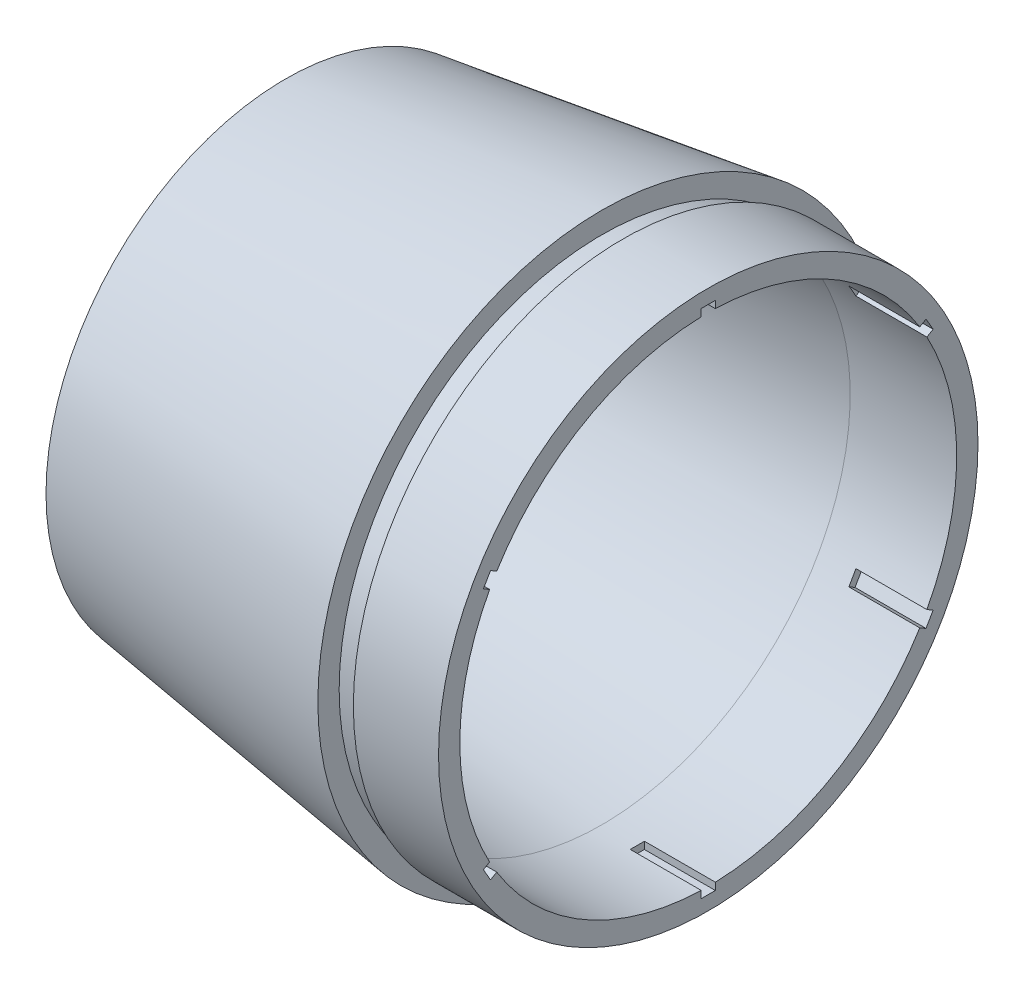
from build123d import *

# Parameters (mm, degrees)
IZIM3_W                 = 10
IZIM3_H                 = 2
KES_EKSTR_ZYON1_DEPTH   = 36
DAIRESEL_KAPLAMA1_COUNT = 6


with BuildPart() as part:
    # Çizim1 → Döndür2 (revolve)
    with BuildSketch(Plane.XY):
        Polygon((0, 40), (-44.562063093, 33.737210457), (-44.562063093, 31.737210457), (-33.555064496, 31.737210457), (0, 35), (15, 35), (15, 38), (3, 38), (3, 37), (0, 37), align=None)
    revolve(axis=Axis((-44.316348886, 0, 0), (1, 0, 0)))

    # Çizim3 → Kes-Ekstrüzyon1 (cut)
    with BuildSketch(Plane(origin=(0, 0, 0), x_dir=(1, 0, 0), z_dir=(0, 1, 0))):
        with Locations((10, 0)):
            Rectangle(IZIM3_W, IZIM3_H)
    kes_ekstr_zyon1 = extrude(amount=-KES_EKSTR_ZYON1_DEPTH, mode=Mode.SUBTRACT)

    # Dairesel Kaplama1: Kes-Ekstrüzyon1 ×6 about axis
    dairesel_kaplama1_axis = Axis((0, 0, 0), (-1, 0, 0))
    for i in range(1, DAIRESEL_KAPLAMA1_COUNT):
        add(kes_ekstr_zyon1.rotate(dairesel_kaplama1_axis, i * 360 / DAIRESEL_KAPLAMA1_COUNT), mode=Mode.SUBTRACT)


solid = part.part
